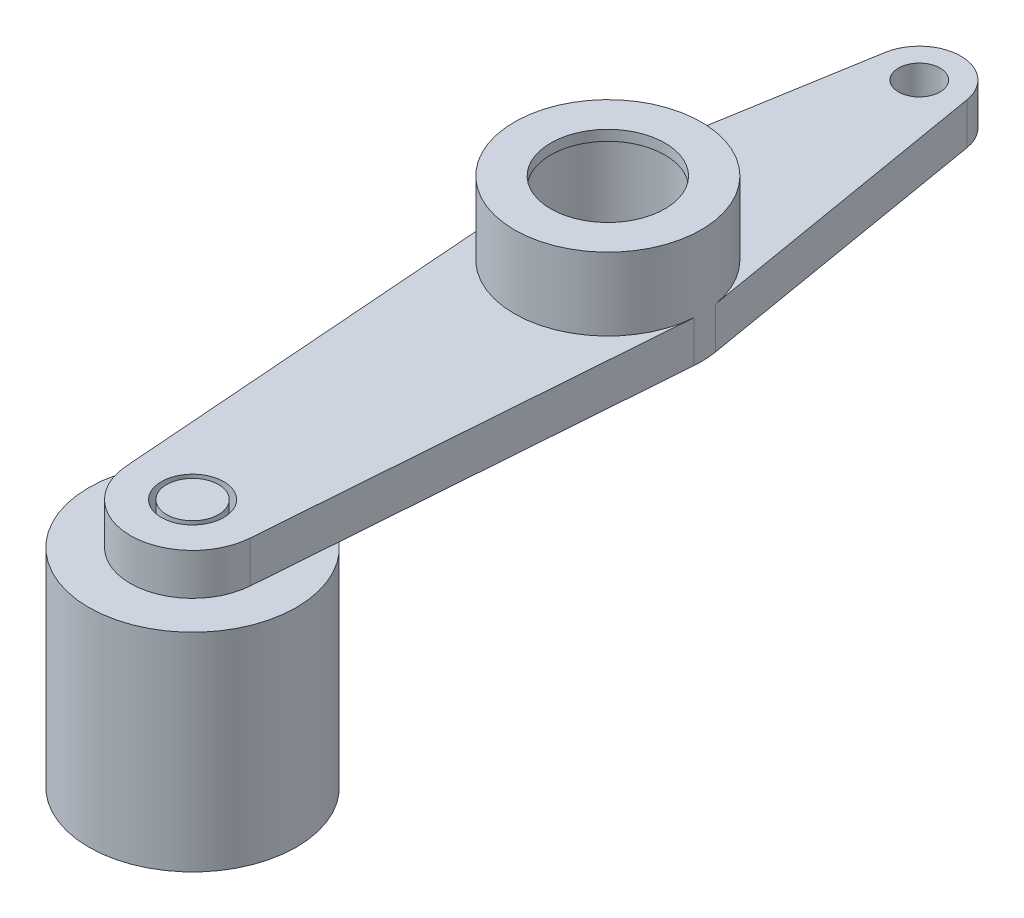
from build123d import *

# Parameters (mm, degrees)
EXTRUDE_1_DEPTH       = 4
SKETCH_3_R            = 9
EXTRUDE_2_DEPTH       = 7
SKETCH_4_R            = 3
CUT_EXTRUDE_1_DEPTH   = 48.391982444
SKETCH_5_R            = 6
CUT_EXTRUDE_2_DEPTH   = 10
SKETCH_7_R            = 5.5
CUT_EXTRUDE_3_DEPTH   = 49.145612469
HOLE_WIZARD_4_0_4_1_D = 4
SCALE1_SCALE          = 2
SKETCH1_R             = 20
EXTRUDE1_DEPTH        = 40
SKETCH2_R             = 5
EXTRUDE2_DEPTH        = 8
SKETCH3_W             = 4
SKETCH3_H             = 1
SKETCH3_W_2           = 4.944968004
SKETCH3_H_2           = 0.773994992
EXTRUDE3_DEPTH        = 4


with BuildPart() as part:
    # 草图1 → 凸台-拉伸1 (new body)
    with BuildSketch(Plane(origin=(0, 0, 0), x_dir=(1, 0, 0), z_dir=(0, 1, 0))):
        with BuildLine():
            Line((-8.974651804, -0.675), (-5.983101203, -40.45))
            ThreePointArc((-5.983101203, -40.45), (0, -46), (5.983101203, -40.45))
            Line((5.983101203, -40.45), (8.974651804, -0.675))
            ThreePointArc((8.974651804, -0.675), (8.990401386, 0.415551353), (8.874119675, 1.5))
            Line((8.874119675, 1.5), (3.944053189, 30.666666667))
            ThreePointArc((3.944053189, 30.666666667), (0, 34), (-3.944053189, 30.666666667))
            Line((-3.944053189, 30.666666667), (-8.874119675, 1.5))
            ThreePointArc((-8.874119675, 1.5), (-8.990401386, 0.415551353), (-8.974651804, -0.675))
        make_face()
    extrude(amount=EXTRUDE_1_DEPTH)

    # 草图3 → 凸台-拉伸2 (add)
    with BuildSketch(Plane(origin=(0, 4, 0), x_dir=(1, 0, 0), z_dir=(0, 1, 0))):
        with Locations(Location((0, 0, 0), (0, 0, 9.594068227))):
            Circle(SKETCH_3_R)
    extrude(amount=EXTRUDE_2_DEPTH)

    # 草图4 → 切除-拉伸1 (cut, through all)
    with BuildSketch(Plane(origin=(0, 4, 0), x_dir=(1, 0, 0), z_dir=(0, 1, 0))):
        with Locations(Location((0, -40, 0), (0, 0, 270))):
            Circle(SKETCH_4_R)
    extrude(amount=-CUT_EXTRUDE_1_DEPTH, mode=Mode.SUBTRACT)

    # 草图5 → 切除-拉伸2 (cut)
    with BuildSketch(Plane.XZ):
        with Locations(Location((0, 0, 0), (0, 0, 270))):
            Circle(SKETCH_5_R)
    extrude(amount=-CUT_EXTRUDE_2_DEPTH, mode=Mode.SUBTRACT)

    # 草图7 → 切除-拉伸3 (cut, through all)
    with BuildSketch(Plane(origin=(0, 11, 0), x_dir=(1, 0, 0), z_dir=(0, 1, 0))):
        with Locations(Location((0, 0, 0), (0, 0, 270))):
            Circle(SKETCH_7_R)
    extrude(amount=-CUT_EXTRUDE_3_DEPTH, mode=Mode.SUBTRACT)

    # Ø4.0 (4) 直径孔1 (through all)
    with Locations(Plane(origin=(0, 4, 0), x_dir=(1, 0, 0), z_dir=(0, 1, 0))):
        with Locations((0, 30)):
            Hole(HOLE_WIZARD_4_0_4_1_D / 2)


with BuildPart() as part_1:
    # Scale1: scaled about (0, 3.188915264, 5.875445323)
    add(part.part.scale(SCALE1_SCALE).moved(Location((0, -3.188915264, -5.875445323))))

    # Sketch1 → Extrude1 (add)
    with BuildSketch(Plane.XZ.offset(3.188915264)):
        with Locations(Location((0, 74.124554677, 0), (0, 0, 228.828880049))):
            Circle(SKETCH1_R)
    extrude(amount=EXTRUDE1_DEPTH)

    # Sketch2 → Extrude2 (add)
    with BuildSketch(Plane(origin=(0, -3.188915264, 0), x_dir=(1, 0, 0), z_dir=(0, 1, 0))):
        with Locations(Location((0, -74.124554677, 0), (0, 0, 90))):
            Circle(SKETCH2_R)
    extrude(amount=EXTRUDE2_DEPTH)

    # Sketch3 → Extrude3 (add)
    with BuildSketch(Plane.XZ.offset(43.188915264)):
        with Locations((0, 87.624554677)):
            Rectangle(SKETCH3_W, SKETCH3_H)
        with Locations((0, 60.737557181)):
            Rectangle(SKETCH3_W_2, SKETCH3_H_2)
    extrude(amount=EXTRUDE3_DEPTH)


solid = part_1.part
